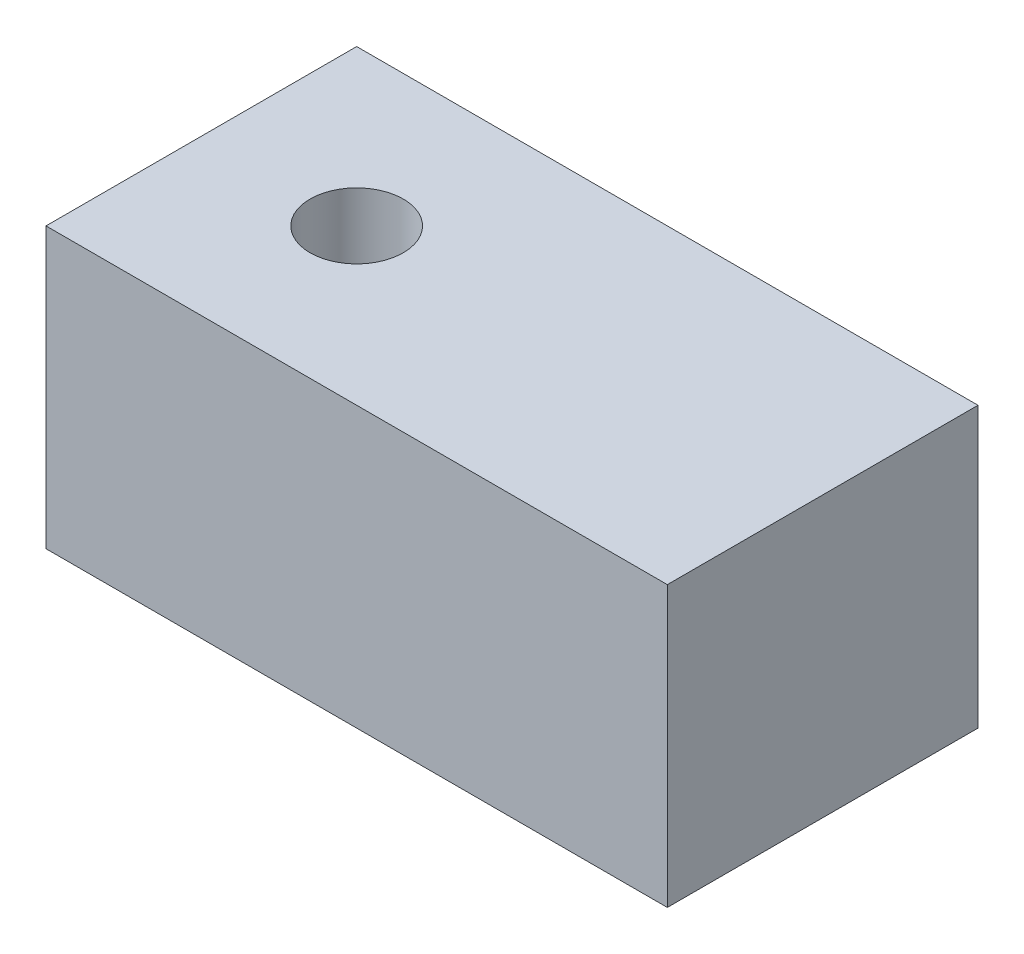
from build123d import *

# Parameters (mm, degrees)
SKETCH_1_W          = 20
SKETCH_1_H          = 10
EXTRUDE_1_DEPTH     = 9
SKETCH_2_R          = 1.5
CUT_EXTRUDE_2_DEPTH = 15.352700094


with BuildPart() as part:
    # 草图1 → 凸台-拉伸1 (new body)
    with BuildSketch(Plane(origin=(0, 0, 0), x_dir=(1, 0, 0), z_dir=(0, 1, 0))):
        Rectangle(SKETCH_1_W, SKETCH_1_H)
    extrude(amount=EXTRUDE_1_DEPTH)

    # 草图2 → 切除-拉伸2 (cut, through all)
    with BuildSketch(Plane(origin=(0, 9, 0), x_dir=(1, 0, 0), z_dir=(0, 1, 0))):
        with Locations(Location((-5, 0, 0), (0, 0, 270))):
            Circle(SKETCH_2_R)
    extrude(amount=-CUT_EXTRUDE_2_DEPTH, mode=Mode.SUBTRACT)


solid = part.part
